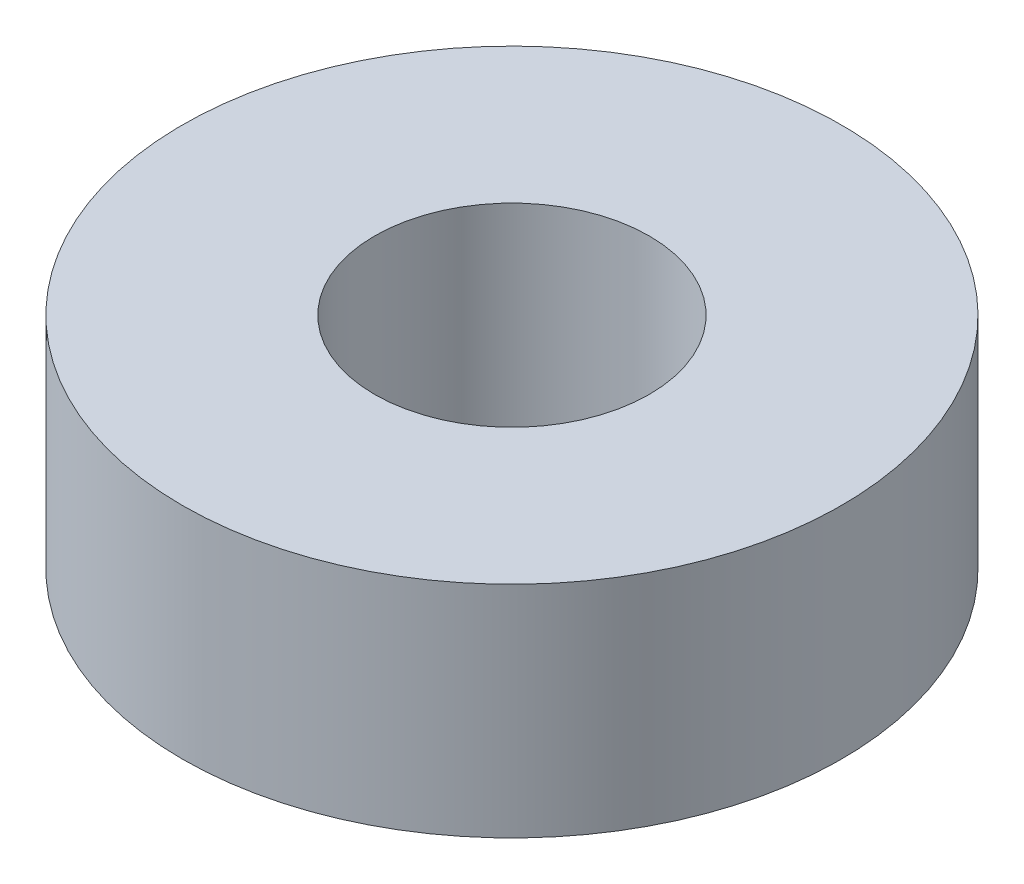
from build123d import *

# Parameters (mm, degrees)
SKETCH1_R           = 4.7625
SKETCH1_R_2         = 1.984375
BOSS_EXTRUDE1_DEPTH = 3.175


with BuildPart() as part:
    # Sketch1 → Boss-Extrude1 (new body)
    with BuildSketch(Plane(origin=(0, 0, 0), x_dir=(1, 0, 0), z_dir=(0, 1, 0))):
        with Locations(Location((0, 0, 0), (0, 0, 270))):
            Circle(SKETCH1_R)
        with Locations(Location((0, 0, 0), (0, 0, 270))):
            Circle(SKETCH1_R_2, mode=Mode.SUBTRACT)
    extrude(amount=BOSS_EXTRUDE1_DEPTH)


solid = part.part
